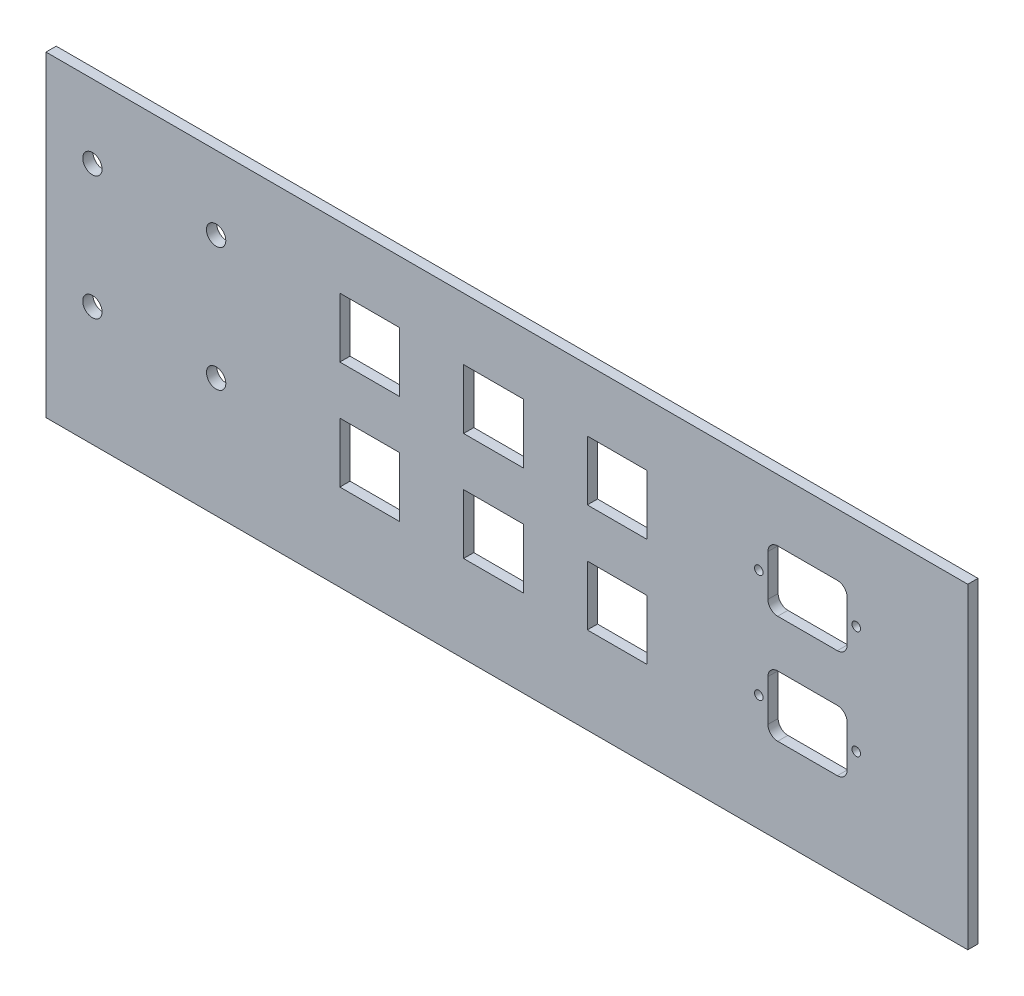
from build123d import *

# Parameters (mm, degrees)
SKETCH1_W               = 378.46
SKETCH1_H               = 129.9972
BOSS_EXTRUDE1_DEPTH     = 4.191
F_3_8_16_TAPPED_HOLE1_D = 7.9375
CUT_EXTRUDE1_REACH      = 402.186
SKETCH5_W               = 24.5
SKETCH5_H               = 24.5
CUT_EXTRUDE2_REACH      = 402.186
SKETCH7_R               = 1.75


with BuildPart() as part:
    # Sketch1 → Boss-Extrude1 (new body)
    with BuildSketch(Plane.XY):
        with Locations((189.23, 64.9986)):
            Rectangle(SKETCH1_W, SKETCH1_H)
    extrude(amount=BOSS_EXTRUDE1_DEPTH)

    # 3/8-16 Tapped Hole1 (through all)
    with Locations(Plane.XY.offset(4.191)):
        with Locations((19.05, 99.8347), (69.85, 99.8347), (69.85, 49.0347), (19.05, 49.0347)):
            Hole(F_3_8_16_TAPPED_HOLE1_D / 2)

    # Sketch5 → Cut-Extrude1 (cut, up to next)
    with BuildSketch(Plane.XY.offset(4.191), mode=Mode.PRIVATE) as cut_extrude1_sk1:
        with Locations((132.9, 92.3472)):
            Rectangle(SKETCH5_W, SKETCH5_H)
    cut_extrude1_tool1 = extrude(cut_extrude1_sk1.sketch, amount=-CUT_EXTRUDE1_REACH, mode=Mode.PRIVATE) & part.part
    # Sketch5 → Cut-Extrude1 (cut, up to next)
    with BuildSketch(Plane.XY.offset(4.191), mode=Mode.PRIVATE) as cut_extrude1_sk2:
        with Locations((183.7, 92.3472)):
            Rectangle(SKETCH5_W, SKETCH5_H)
    cut_extrude1_tool2 = extrude(cut_extrude1_sk2.sketch, amount=-CUT_EXTRUDE1_REACH, mode=Mode.PRIVATE) & part.part
    # Sketch5 → Cut-Extrude1 (cut, up to next)
    with BuildSketch(Plane.XY.offset(4.191), mode=Mode.PRIVATE) as cut_extrude1_sk3:
        with Locations((234.5, 92.3472)):
            Rectangle(SKETCH5_W, SKETCH5_H)
    cut_extrude1_tool3 = extrude(cut_extrude1_sk3.sketch, amount=-CUT_EXTRUDE1_REACH, mode=Mode.PRIVATE) & part.part
    # Sketch5 → Cut-Extrude1 (cut, up to next)
    with BuildSketch(Plane.XY.offset(4.191), mode=Mode.PRIVATE) as cut_extrude1_sk4:
        with Locations((183.7, 47.8972)):
            Rectangle(SKETCH5_W, SKETCH5_H)
    cut_extrude1_tool4 = extrude(cut_extrude1_sk4.sketch, amount=-CUT_EXTRUDE1_REACH, mode=Mode.PRIVATE) & part.part
    # Sketch5 → Cut-Extrude1 (cut, up to next)
    with BuildSketch(Plane.XY.offset(4.191), mode=Mode.PRIVATE) as cut_extrude1_sk5:
        with Locations((234.5, 47.8972)):
            Rectangle(SKETCH5_W, SKETCH5_H)
    cut_extrude1_tool5 = extrude(cut_extrude1_sk5.sketch, amount=-CUT_EXTRUDE1_REACH, mode=Mode.PRIVATE) & part.part
    # Sketch5 → Cut-Extrude1 (cut, up to next)
    with BuildSketch(Plane.XY.offset(4.191), mode=Mode.PRIVATE) as cut_extrude1_sk6:
        with Locations((132.9, 47.8972)):
            Rectangle(SKETCH5_W, SKETCH5_H)
    cut_extrude1_tool6 = extrude(cut_extrude1_sk6.sketch, amount=-CUT_EXTRUDE1_REACH, mode=Mode.PRIVATE) & part.part
    add(cut_extrude1_tool1.solids().sort_by_distance((132.9, 92.3472, 4.191))[0], mode=Mode.SUBTRACT)
    add(cut_extrude1_tool2.solids().sort_by_distance((183.7, 92.3472, 4.191))[0], mode=Mode.SUBTRACT)
    add(cut_extrude1_tool3.solids().sort_by_distance((234.5, 92.3472, 4.191))[0], mode=Mode.SUBTRACT)
    add(cut_extrude1_tool4.solids().sort_by_distance((183.7, 47.8972, 4.191))[0], mode=Mode.SUBTRACT)
    add(cut_extrude1_tool5.solids().sort_by_distance((234.5, 47.8972, 4.191))[0], mode=Mode.SUBTRACT)
    add(cut_extrude1_tool6.solids().sort_by_distance((132.9, 47.8972, 4.191))[0], mode=Mode.SUBTRACT)

    # Sketch7 → Cut-Extrude2 (cut, up to next)
    with BuildSketch(Plane.XY.offset(4.191), mode=Mode.PRIVATE) as cut_extrude2_sk1:
        with Locations((292.657, 92.0972)):
            Circle(SKETCH7_R)
    cut_extrude2_tool1 = extrude(cut_extrude2_sk1.sketch, amount=-CUT_EXTRUDE2_REACH, mode=Mode.PRIVATE) & part.part
    # Sketch7 → Cut-Extrude2 (cut, up to next)
    with BuildSketch(Plane.XY.offset(4.191), mode=Mode.PRIVATE) as cut_extrude2_sk2:
        with Locations((332.657, 92.0972)):
            Circle(SKETCH7_R)
    cut_extrude2_tool2 = extrude(cut_extrude2_sk2.sketch, amount=-CUT_EXTRUDE2_REACH, mode=Mode.PRIVATE) & part.part
    # Sketch7 → Cut-Extrude2 (cut, up to next)
    with BuildSketch(Plane.XY.offset(4.191), mode=Mode.PRIVATE) as cut_extrude2_sk3:
        with Locations((332.657, 47.6472)):
            Circle(SKETCH7_R)
    cut_extrude2_tool3 = extrude(cut_extrude2_sk3.sketch, amount=-CUT_EXTRUDE2_REACH, mode=Mode.PRIVATE) & part.part
    # Sketch7 → Cut-Extrude2 (cut, up to next)
    with BuildSketch(Plane.XY.offset(4.191), mode=Mode.PRIVATE) as cut_extrude2_sk4:
        with Locations((292.657, 47.6472)):
            Circle(SKETCH7_R)
    cut_extrude2_tool4 = extrude(cut_extrude2_sk4.sketch, amount=-CUT_EXTRUDE2_REACH, mode=Mode.PRIVATE) & part.part
    # Sketch7 → Cut-Extrude2 (cut, up to next)
    with BuildSketch(Plane.XY.offset(4.191), mode=Mode.PRIVATE) as cut_extrude2_sk5:
        with BuildLine():
            Line((300.407, 60.1472), (324.907, 60.1472))
            ThreePointArc((324.907, 60.1472), (327.735427125, 58.975627125), (328.907, 56.1472))
            Line((328.907, 56.1472), (328.907, 39.1472))
            ThreePointArc((328.907, 39.1472), (327.735427125, 36.318772875), (324.907, 35.1472))
            Line((324.907, 35.1472), (300.407, 35.1472))
            ThreePointArc((300.407, 35.1472), (297.578572875, 36.318772875), (296.407, 39.1472))
            Line((296.407, 39.1472), (296.407, 56.1472))
            ThreePointArc((296.407, 56.1472), (297.578572875, 58.975627125), (300.407, 60.1472))
        make_face()
    cut_extrude2_tool5 = extrude(cut_extrude2_sk5.sketch, amount=-CUT_EXTRUDE2_REACH, mode=Mode.PRIVATE) & part.part
    # Sketch7 → Cut-Extrude2 (cut, up to next)
    with BuildSketch(Plane.XY.offset(4.191), mode=Mode.PRIVATE) as cut_extrude2_sk6:
        with BuildLine():
            Line((300.407, 104.5972), (324.907, 104.5972))
            ThreePointArc((324.907, 104.5972), (327.735427125, 103.425627125), (328.907, 100.5972))
            Line((328.907, 100.5972), (328.907, 83.5972))
            ThreePointArc((328.907, 83.5972), (327.735427125, 80.768772875), (324.907, 79.5972))
            Line((324.907, 79.5972), (300.407, 79.5972))
            ThreePointArc((300.407, 79.5972), (297.578572875, 80.768772875), (296.407, 83.5972))
            Line((296.407, 83.5972), (296.407, 100.5972))
            ThreePointArc((296.407, 100.5972), (297.578572875, 103.425627125), (300.407, 104.5972))
        make_face()
    cut_extrude2_tool6 = extrude(cut_extrude2_sk6.sketch, amount=-CUT_EXTRUDE2_REACH, mode=Mode.PRIVATE) & part.part
    add(cut_extrude2_tool1.solids().sort_by_distance((292.657, 92.0972, 4.191))[0], mode=Mode.SUBTRACT)
    add(cut_extrude2_tool2.solids().sort_by_distance((332.657, 92.0972, 4.191))[0], mode=Mode.SUBTRACT)
    add(cut_extrude2_tool3.solids().sort_by_distance((332.657, 47.6472, 4.191))[0], mode=Mode.SUBTRACT)
    add(cut_extrude2_tool4.solids().sort_by_distance((292.657, 47.6472, 4.191))[0], mode=Mode.SUBTRACT)
    add(cut_extrude2_tool5.solids().sort_by_distance((312.657, 47.6472, 4.191))[0], mode=Mode.SUBTRACT)
    add(cut_extrude2_tool6.solids().sort_by_distance((312.657, 92.0972, 4.191))[0], mode=Mode.SUBTRACT)


solid = part.part
